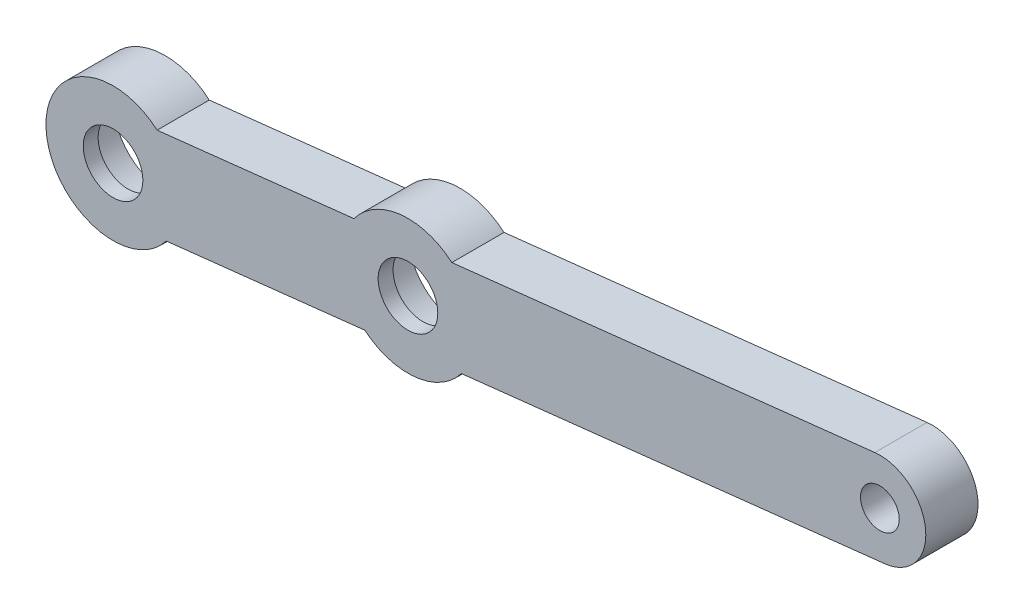
from build123d import *

# Parameters (mm, degrees)
SKETCH1_R           = 2.6
SKETCH1_R_2         = 6.9
BOSS_EXTRUDE1_DEPTH = 5
SKETCH2_R           = 2.6
SKETCH2_R_2         = 4
BOSS_EXTRUDE2_DEPTH = 2


with BuildPart() as part:
    # Sketch1 → Boss-Extrude1 (new body)
    with BuildSketch(Plane.XY):
        with BuildLine():
            Line((-117.842377899, -77.068349263), (-91.221161774, -74.112086796))
            ThreePointArc((-91.221161774, -74.112086796), (-84.435913767, -76.1684327), (-78.267124508, -72.673552434))
            Line((-78.267124508, -72.673552434), (-21.451382857, -66.364214657))
            ThreePointArc((-21.451382857, -66.364214657), (-16.007105356, -59.559722092), (-22.811597922, -54.115444591))
            Line((-22.811597922, -54.115444591), (-79.542760834, -60.415389973))
            ThreePointArc((-79.542760834, -60.415389973), (-86.42258563, -58.278403776), (-92.665955577, -61.872709124))
            Line((-92.665955577, -61.872709124), (-119.079141177, -64.805869985))
            ThreePointArc((-119.079141177, -64.805869985), (-133.941604274, -72.498469269), (-117.842377899, -77.068349263))
        make_face()
        with Locations((-22.131490389, -60.239829624)):
            Circle(SKETCH1_R, mode=Mode.SUBTRACT)
        with Locations((-85.429249698, -67.223418238)):
            Circle(SKETCH1_R_2, mode=Mode.SUBTRACT)
        with Locations((-124.987033061, -71.595333402)):
            Circle(SKETCH1_R_2, mode=Mode.SUBTRACT)
    extrude(amount=BOSS_EXTRUDE1_DEPTH)

    # Sketch2 → Boss-Extrude2 (add)
    with BuildSketch(Plane.XY.offset(5)):
        with BuildLine():
            Line((-22.811597922, -54.115444591), (-79.542760834, -60.415389973))
            ThreePointArc((-79.542760834, -60.415389973), (-86.42258563, -58.278403776), (-92.665955577, -61.872709124))
            Line((-92.665955577, -61.872709124), (-119.079141177, -64.805869985))
            ThreePointArc((-119.079141177, -64.805869985), (-133.941604274, -72.498469269), (-117.842377899, -77.068349263))
            Line((-117.842377899, -77.068349263), (-91.221161774, -74.112086796))
            ThreePointArc((-91.221161774, -74.112086796), (-84.435913767, -76.1684327), (-78.267124508, -72.673552434))
            Line((-78.267124508, -72.673552434), (-21.451382857, -66.364214657))
            ThreePointArc((-21.451382857, -66.364214657), (-16.007105356, -59.559722092), (-22.811597922, -54.115444591))
        make_face()
        with Locations((-22.131490389, -60.239829624)):
            Circle(SKETCH2_R, mode=Mode.SUBTRACT)
        with Locations((-85.429249698, -67.223418238)):
            Circle(SKETCH2_R_2, mode=Mode.SUBTRACT)
        with Locations((-124.987033061, -71.595333402)):
            Circle(SKETCH2_R_2, mode=Mode.SUBTRACT)
    extrude(amount=BOSS_EXTRUDE2_DEPTH)


solid = part.part
